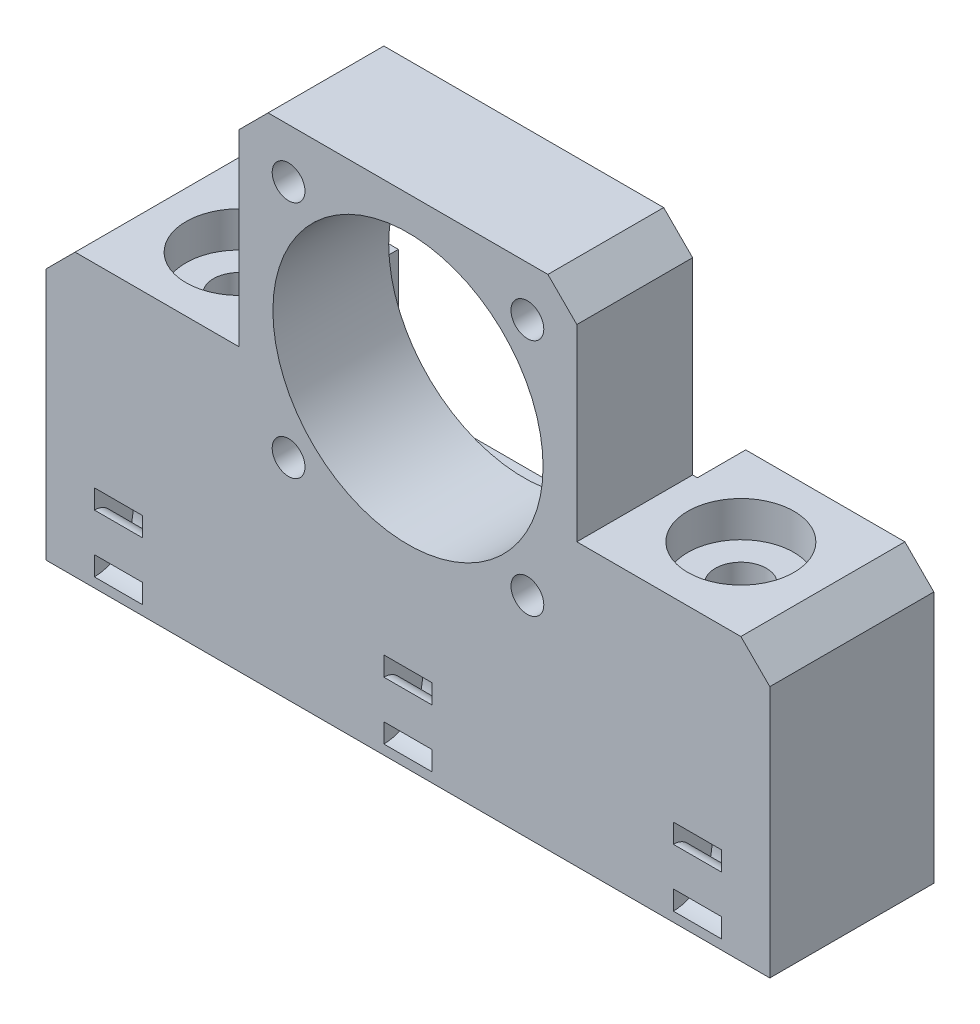
from build123d import *

# Parameters (mm, degrees)
ESQUISSE1_R                                        = 14
ESQUISSE1_R_2                                      = 1.7
BOSS_EXTRU_1_DEPTH                                 = 17
BOSS_EXTRU_2_START                                 = -17
ESQUISSE2_R                                        = 1.7
ESQUISSE2_R_2                                      = 14
BOSS_EXTRU_2_DEPTH                                 = 17
CHAMBRAGE_POUR_VIS_T_TE_RONDE_BOMB_E_M_D           = 5.3
CHAMBRAGE_POUR_VIS_T_TE_RONDE_BOMB_E_M_DEPTH       = 35
CHAMBRAGE_POUR_VIS_T_TE_RONDE_BOMB_E_M_CBORE_D     = 11
CHAMBRAGE_POUR_VIS_T_TE_RONDE_BOMB_E_M_CBORE_DEPTH = 3.7
CHAMBRAGE_POUR_VIS_T_TE_RONDE_BOMB_E_M_TIP         = 1.59228064
ESQUISSE7_W                                        = 5
ESQUISSE7_H                                        = 2
ENL_V_MAT_EXTRU_1_DEPTH                            = 5
ENL_V_MAT_EXTRU_2_DEPTH                            = 5


with BuildPart() as part:
    # Esquisse1 → Boss.-Extru.1 (new body)
    with BuildSketch(Plane.XY):
        with BuildLine():
            Line((12.489995997, 17.5), (-12.489995997, 17.5))
            ThreePointArc((-12.489995997, 17.5), (-15.202795796, 15.202795796), (-17.5, 12.489995997))
            Line((-17.5, 12.489995997), (-17.5, -12.489995997))
            ThreePointArc((-17.5, -12.489995997), (-15.202795796, -15.202795796), (-12.489995997, -17.5))
            Line((-12.489995997, -17.5), (12.489995997, -17.5))
            ThreePointArc((12.489995997, -17.5), (15.202795796, -15.202795796), (17.5, -12.489995997))
            Line((17.5, -12.489995997), (17.5, 12.489995997))
            ThreePointArc((17.5, 12.489995997), (15.202795796, 15.202795796), (12.489995997, 17.5))
        make_face()
        Circle(ESQUISSE1_R, mode=Mode.SUBTRACT)
        with Locations((-12.374368671, -12.374368671)):
            Circle(ESQUISSE1_R_2, mode=Mode.SUBTRACT)
        with Locations((12.374368671, -12.374368671)):
            Circle(ESQUISSE1_R_2, mode=Mode.SUBTRACT)
        with Locations((12.374368671, 12.374368671)):
            Circle(ESQUISSE1_R_2, mode=Mode.SUBTRACT)
        with Locations((-12.374368671, 12.374368671)):
            Circle(ESQUISSE1_R_2, mode=Mode.SUBTRACT)
    extrude(amount=BOSS_EXTRU_1_DEPTH)

    # Esquisse2 → Boss.-Extru.2 (add)
    with BuildSketch(Plane.XY.offset(17).offset(BOSS_EXTRU_2_START)):
        Polygon((-12.489995997, 17.5), (-14.5, 17.5), (-17.5, 14.5), (-17.5, -5), (-34.5, -5), (-37.5, -8), (-37.5, -34.15), (37.5, -34.15), (37.5, -8), (34.5, -5), (17.5, -5), (17.5, 14.5), (14.5, 17.5), align=None)
        with Locations((12.374368671, 12.374368671)):
            Circle(ESQUISSE2_R, mode=Mode.SUBTRACT)
        with Locations((12.374368671, -12.374368671)):
            Circle(ESQUISSE2_R, mode=Mode.SUBTRACT)
        with Locations((-12.374368671, -12.374368671)):
            Circle(ESQUISSE2_R, mode=Mode.SUBTRACT)
        with Locations((-12.374368671, 12.374368671)):
            Circle(ESQUISSE2_R, mode=Mode.SUBTRACT)
        Circle(ESQUISSE2_R_2, mode=Mode.SUBTRACT)
    extrude(amount=BOSS_EXTRU_2_DEPTH)

    # Chambrage pour vis à tête ronde bombée M51
    with Locations(Plane(origin=(0, -5, 0), x_dir=(1, 0, 0), z_dir=(0, 1, 0))):
        with Locations((-26, -8.5), (26, -8.5)):
            CounterBoreHole(CHAMBRAGE_POUR_VIS_T_TE_RONDE_BOMB_E_M_D / 2, CHAMBRAGE_POUR_VIS_T_TE_RONDE_BOMB_E_M_CBORE_D / 2, CHAMBRAGE_POUR_VIS_T_TE_RONDE_BOMB_E_M_CBORE_DEPTH, depth=CHAMBRAGE_POUR_VIS_T_TE_RONDE_BOMB_E_M_DEPTH)
            with Locations((0, 0, -(CHAMBRAGE_POUR_VIS_T_TE_RONDE_BOMB_E_M_DEPTH + CHAMBRAGE_POUR_VIS_T_TE_RONDE_BOMB_E_M_TIP / 2))):  # 118° drill point
                Cone(0, CHAMBRAGE_POUR_VIS_T_TE_RONDE_BOMB_E_M_D / 2, CHAMBRAGE_POUR_VIS_T_TE_RONDE_BOMB_E_M_TIP, mode=Mode.SUBTRACT)

    # Esquisse7 → Enlèvement de matière-Révolution1 (revolve, cut)
    with BuildSketch(Plane.XY.offset(17)):
        with Locations((0, -26.15)):
            Rectangle(ESQUISSE7_W, ESQUISSE7_H)
        with Locations((-30, -26.15)):
            Rectangle(ESQUISSE7_W, ESQUISSE7_H)
        with Locations((30, -26.15)):
            Rectangle(ESQUISSE7_W, ESQUISSE7_H)
    revolve(axis=Axis((-37.5, -29.15, 17), (1, 0, 0)), mode=Mode.SUBTRACT)

    # Esquisse8 → Enlèv. mat.-Extru.1 (cut)
    with BuildSketch(Plane(origin=(0, 0, 0), x_dir=(-1, 0, 0), z_dir=(0, 0, -1))):
        with BuildLine():
            Line((-12.489995997, 17.5), (-14.5, 17.5))
            Line((-14.5, 17.5), (-17.5, 14.5))
            Line((-17.5, 14.5), (-17.5, 12.489995997))
            Line((-17.5, 12.489995997), (-17.5, -12.489995997))
            ThreePointArc((-17.5, -12.489995997), (-15.202795796, -15.202795796), (-12.489995997, -17.5))
            Line((-12.489995997, -17.5), (12.489995997, -17.5))
            ThreePointArc((12.489995997, -17.5), (15.202795796, -15.202795796), (17.5, -12.489995997))
            Line((17.5, -12.489995997), (17.5, 12.489995997))
            Line((17.5, 12.489995997), (17.5, 14.5))
            Line((17.5, 14.5), (14.5, 17.5))
            Line((14.5, 17.5), (12.489995997, 17.5))
            Line((12.489995997, 17.5), (-12.489995997, 17.5))
        make_face()
    extrude(amount=-ENL_V_MAT_EXTRU_1_DEPTH, mode=Mode.SUBTRACT)

    # Esquisse9 → Enlèv. mat.-Extru.2 (cut)
    with BuildSketch(Plane(origin=(0, 0, 0), x_dir=(-1, 0, 0), z_dir=(0, 0, -1))):
        with BuildLine():
            Line((-18, -4.5), (-18, -12.649110641))
            ThreePointArc((-18, -12.649110641), (-15.556349186, -15.556349186), (-12.649110641, -18))
            Line((-12.649110641, -18), (12.649110641, -18))
            ThreePointArc((12.649110641, -18), (15.556349186, -15.556349186), (18, -12.649110641))
            Line((18, -12.649110641), (18, -4.5))
            Line((18, -4.5), (-18, -4.5))
        make_face()
        with BuildLine():
            Line((17.5, -12.489995997), (17.5, -5))
            Line((17.5, -5), (-17.5, -5))
            Line((-17.5, -5), (-17.5, -12.489995997))
            ThreePointArc((-17.5, -12.489995997), (-15.202795796, -15.202795796), (-12.489995997, -17.5))
            Line((-12.489995997, -17.5), (12.489995997, -17.5))
            ThreePointArc((12.489995997, -17.5), (15.202795796, -15.202795796), (17.5, -12.489995997))
        make_face(mode=Mode.SUBTRACT)
    extrude(amount=-ENL_V_MAT_EXTRU_2_DEPTH, mode=Mode.SUBTRACT)


solid = part.part
